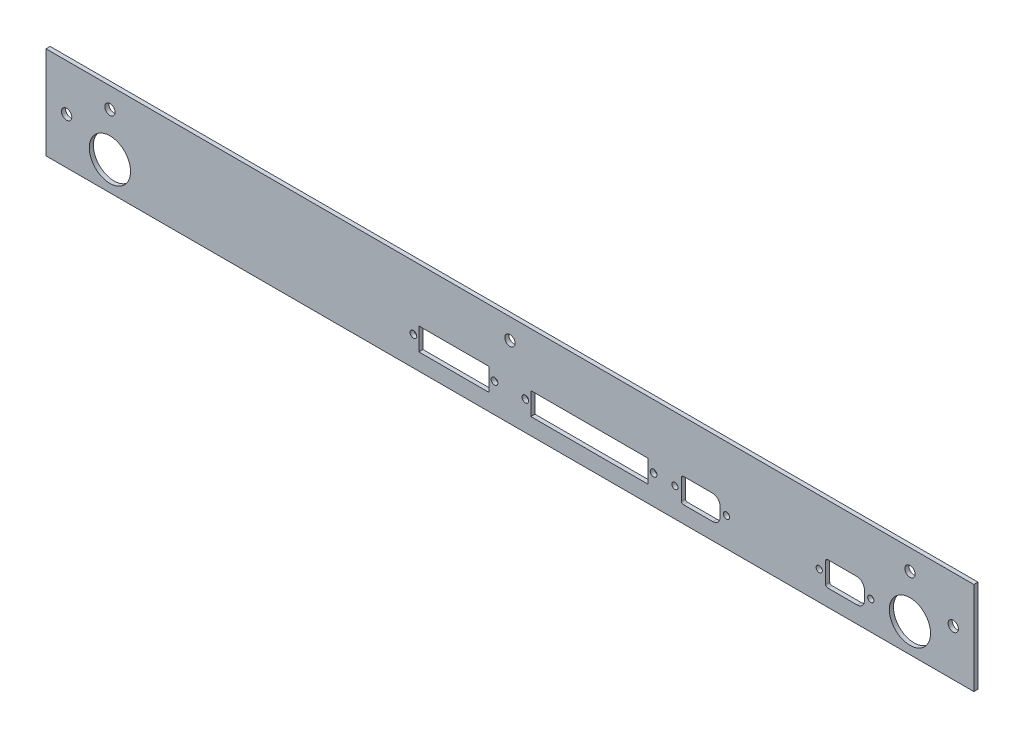
from build123d import *

# Parameters (mm, degrees)
SKETCH1_W                      = 450
SKETCH1_H                      = 45
BOSS_EXTRUDE1_DEPTH            = 2
TERMINAL_12P_CUTOUT_DEPTH      = 227.131046077
TERMINAL_12P_CUTOUT_DEPTH_BACK = 227.131046077
SK_TERMINAL_12P_CUTOUT_R       = 1.625
SK_TERMINAL_12P_CUTOUT_W       = 56.92
SK_TERMINAL_12P_CUTOUT_H       = 10.9
SK_TERMINAL_12P_CUTOUT_W_2     = 34.06
SKETCH2_R                      = 2.5
CUT_EXTRUDE1_DEPTH             = 227.131046077
SKETCH3_R                      = 1.5
SKETCH3_R_2                    = 10
CUT_EXTRUDE2_DEPTH             = 10


with BuildPart() as part:
    # Sketch1 → Boss-Extrude1 (new body)
    with BuildSketch(Plane.XY):
        Rectangle(SKETCH1_W, SKETCH1_H)
    extrude(amount=BOSS_EXTRUDE1_DEPTH)

    # SK Terminal 12P cutout → Terminal 12P cutout (cut, two sides: drawn at the far end of the back side and taken through both)
    with BuildSketch(Plane.XY.offset(-TERMINAL_12P_CUTOUT_DEPTH_BACK)):
        with Locations((7.5, -8.35)):
            Circle(SK_TERMINAL_12P_CUTOUT_R)
        with Locations((69.67, -8.35)):
            Circle(SK_TERMINAL_12P_CUTOUT_R)
        with Locations((-46.81, -8.35)):
            Circle(SK_TERMINAL_12P_CUTOUT_R)
        with Locations((-7.5, -8.35)):
            Circle(SK_TERMINAL_12P_CUTOUT_R)
        with Locations((38.585, -8.95)):
            Rectangle(SK_TERMINAL_12P_CUTOUT_W, SK_TERMINAL_12P_CUTOUT_H)
        with Locations((-27.155, -8.95)):
            Rectangle(SK_TERMINAL_12P_CUTOUT_W_2, SK_TERMINAL_12P_CUTOUT_H)
    extrude(amount=TERMINAL_12P_CUTOUT_DEPTH + TERMINAL_12P_CUTOUT_DEPTH_BACK, mode=Mode.SUBTRACT)

    # Sketch2 → Cut-Extrude1 (cut, through all)
    with BuildSketch(Plane.XY.offset(2)):
        with Locations((-215, 0)):
            Circle(SKETCH2_R)
        with Locations((215, 0)):
            Circle(SKETCH2_R)
        with Locations((-194, 12.495407459)):
            Circle(SKETCH2_R)
        with Locations((194, 12.495407459)):
            Circle(SKETCH2_R)
        with Locations((0, 12.5)):
            Circle(SKETCH2_R)
    extrude(amount=-CUT_EXTRUDE1_DEPTH, mode=Mode.SUBTRACT)

    # Sketch3 → Cut-Extrude2 (cut)
    with BuildSketch(Plane.XY.offset(2)):
        with Locations((150, -8.55)):
            Circle(SKETCH3_R)
        with Locations((175, -8.55)):
            Circle(SKETCH3_R)
        with Locations((80, -8.55)):
            Circle(SKETCH3_R)
        with Locations((105, -8.55)):
            Circle(SKETCH3_R)
        with Locations((194, -8.55)):
            Circle(SKETCH3_R_2)
        with Locations((-194, -8.55)):
            Circle(SKETCH3_R_2)
        with BuildLine():
            Line((168.375, -14.4), (154.1, -14.4))
            ThreePointArc((154.1, -14.4), (153.392893219, -14.107106781), (153.1, -13.4))
            Line((153.1, -13.4), (153.1, -3.7))
            ThreePointArc((153.1, -3.7), (153.451471863, -2.851471863), (154.3, -2.5))
            Line((154.3, -2.5), (168.175, -2.5))
            ThreePointArc((168.175, -2.5), (170.80897276, -3.59102724), (171.9, -6.225))
            Line((171.9, -6.225), (171.9, -10.875))
            ThreePointArc((171.9, -10.875), (170.867551404, -13.367551404), (168.375, -14.4))
        make_face()
        with BuildLine():
            Line((98.375, -14.4), (84.1, -14.4))
            ThreePointArc((84.1, -14.4), (83.392893219, -14.107106781), (83.1, -13.4))
            Line((83.1, -13.4), (83.1, -3.7))
            ThreePointArc((83.1, -3.7), (83.451471863, -2.851471863), (84.3, -2.5))
            Line((84.3, -2.5), (98.175, -2.5))
            ThreePointArc((98.175, -2.5), (100.80897276, -3.59102724), (101.9, -6.225))
            Line((101.9, -6.225), (101.9, -10.875))
            ThreePointArc((101.9, -10.875), (100.867551404, -13.367551404), (98.375, -14.4))
        make_face()
    extrude(amount=-CUT_EXTRUDE2_DEPTH, mode=Mode.SUBTRACT)


solid = part.part
